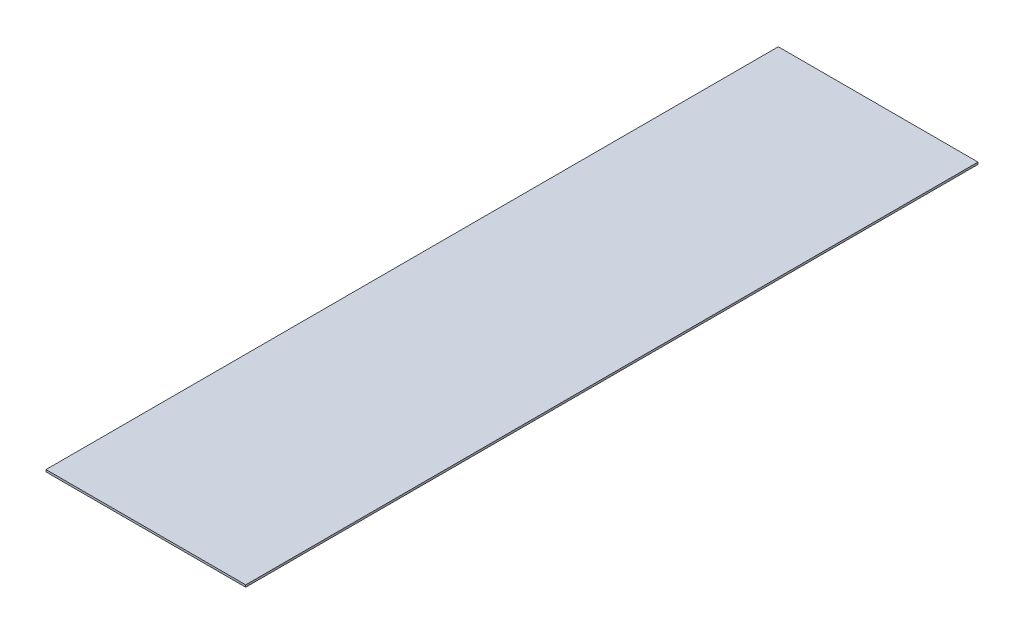
from build123d import *

# Parameters (mm, degrees)
SKETCH1_W           = 76.2
SKETCH1_H           = 279.4
BOSS_EXTRUDE1_DEPTH = 0.79375


with BuildPart() as part:
    # Sketch1 → Boss-Extrude1 (new body)
    with BuildSketch(Plane(origin=(0, 0, 0), x_dir=(1, 0, 0), z_dir=(0, 1, 0))):
        Rectangle(SKETCH1_W, SKETCH1_H)
    extrude(amount=BOSS_EXTRUDE1_DEPTH)


solid = part.part
